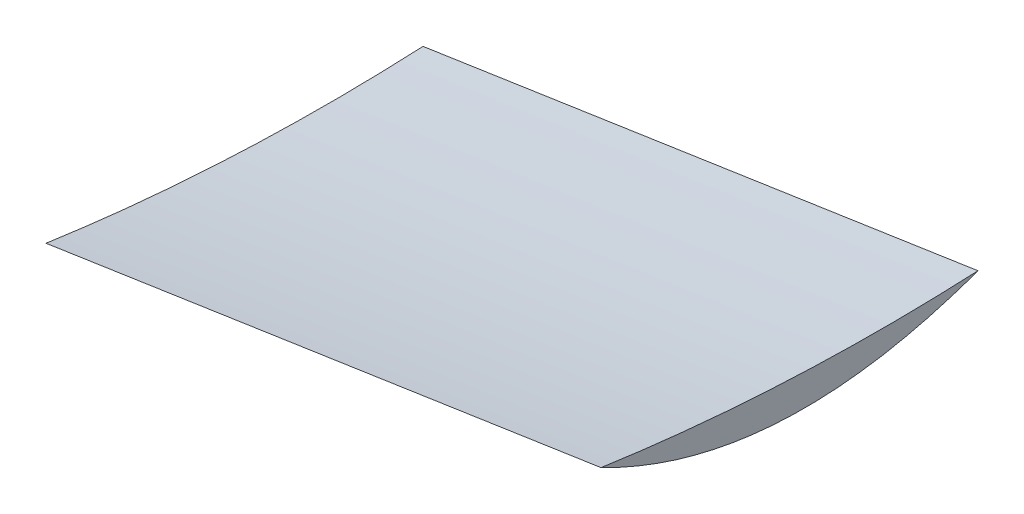
from build123d import *


with BuildPart() as part:
    # Sweep1: sweep along a path in Sketch2
    with BuildLine(Plane(origin=(0, 0, 0), x_dir=(1, 0, 0), z_dir=(0, 1, 0))) as sweep1_path:
        Line((0, 157.491897014), (-635, 45.524264264))
    # Sketch1 → Sweep1 (sweep)
    with BuildSketch(Plane(origin=(0, 0, 0), x_dir=(0, 0, -1), z_dir=(1, 0, 0))):
        with BuildLine():
            add(Edge.make_bspline(
                [(-44.991742267, 21.724903544), (207.265844034, -14.748396326), (462.429907732, -2.508732425)],
                knots=[0, 0, 0, 1, 1, 1], degree=2))
            add(Edge.make_bspline(
                [(-44.991742267, 21.724903544), (192.732864504, -100.101611134), (462.429907732, -2.508732425)],
                knots=[0, 0, 0, 1, 1, 1], degree=2))
        make_face()
    sweep(path=sweep1_path.line)


solid = part.part
